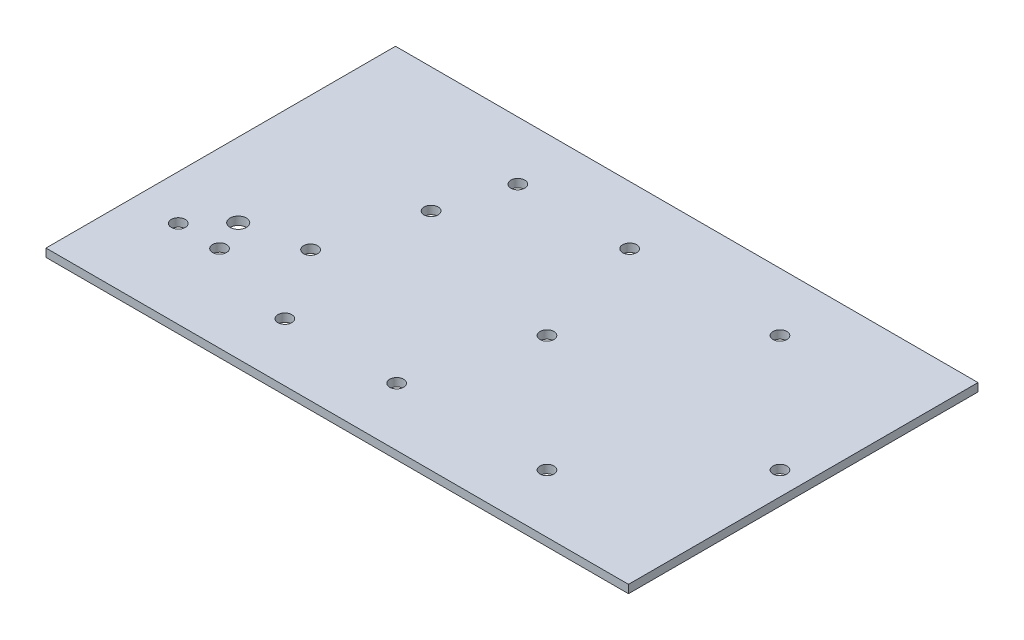
from build123d import *

# Parameters (mm, degrees)
SKETCH_1_W           = 250
SKETCH_1_H           = 150
EXTRUDE_1_DEPTH      = 5
SKETCH_1_4_R         = 3
CUT_EXTRUDE_1_DEPTH  = 5
SKETCH_1_5_R         = 3
CUT_EXTRUDE_2_DEPTH  = 5
SKETCH_1_6_R         = 3
CUT_EXTRUDE_3_DEPTH  = 5
SKETCH_1_7_R         = 3
CUT_EXTRUDE_4_DEPTH  = 5
SKETCH_2_R           = 3
CUT_EXTRUDE_5_DEPTH  = 5
SKETCH_3_R           = 3
CUT_EXTRUDE_6_DEPTH  = 45
SKETCH_3_3_R         = 3.5
CUT_EXTRUDE_7_DEPTH  = 45
SKETCH_4_R           = 3
CUT_EXTRUDE_8_DEPTH  = 5
SKETCH_4_3_R         = 3
CUT_EXTRUDE_9_DEPTH  = 5
SKETCH_5_R           = 3
CUT_EXTRUDE_10_DEPTH = 5
SKETCH_6_W           = 250
SKETCH_6_H           = 150
SKETCH_6_R           = 3
SKETCH_6_R_2         = 3.5
CUT_EXTRUDE_11_DEPTH = 1.5
SKETCH_7_R           = 3
CUT_EXTRUDE_12_DEPTH = 205.296965225


with BuildPart() as part:
    # 草圖1 → 填料-伸長1 (new body)
    with BuildSketch(Plane(origin=(0, 0, 0), x_dir=(1, 0, 0), z_dir=(0, 1, 0))):
        with Locations((-65, 0)):
            Rectangle(SKETCH_1_W, SKETCH_1_H)
    extrude(amount=-EXTRUDE_1_DEPTH)

    # 草圖1<4> → 除料-伸長1 (cut)
    with BuildSketch(Plane(origin=(0, 0, 0), x_dir=(1, 0, 0), z_dir=(0, 1, 0))):
        with Locations((0, 50)):
            Circle(SKETCH_1_4_R)
    extrude(amount=-CUT_EXTRUDE_1_DEPTH, mode=Mode.SUBTRACT)

    # 草圖1<5> → 除料-伸長2 (cut)
    with BuildSketch(Plane(origin=(0, 0, 0), x_dir=(1, 0, 0), z_dir=(0, 1, 0))):
        with Locations((-50, 0)):
            Circle(SKETCH_1_5_R)
    extrude(amount=-CUT_EXTRUDE_2_DEPTH, mode=Mode.SUBTRACT)

    # 草圖1<6> → 除料-伸長3 (cut)
    with BuildSketch(Plane(origin=(0, 0, 0), x_dir=(1, 0, 0), z_dir=(0, 1, 0))):
        with Locations((0, -50)):
            Circle(SKETCH_1_6_R)
    extrude(amount=-CUT_EXTRUDE_3_DEPTH, mode=Mode.SUBTRACT)

    # 草圖1<7> → 除料-伸長4 (cut)
    with BuildSketch(Plane(origin=(0, 0, 0), x_dir=(1, 0, 0), z_dir=(0, 1, 0))):
        with Locations((50, 0)):
            Circle(SKETCH_1_7_R)
    extrude(amount=-CUT_EXTRUDE_4_DEPTH, mode=Mode.SUBTRACT)

    # 草圖2 → 除料-伸長5 (cut)
    with BuildSketch(Plane(origin=(0, 0, 0), x_dir=(1, 0, 0), z_dir=(0, 1, 0))):
        with Locations((-170.76, -37.46)):
            Circle(SKETCH_2_R)
    extrude(amount=-CUT_EXTRUDE_5_DEPTH, mode=Mode.SUBTRACT)

    # 草圖3 → 除料-伸長6 (cut)
    with BuildSketch(Plane(origin=(0, 0, 0), x_dir=(1, 0, 0), z_dir=(0, 1, 0))):
        with Locations((-152.57, -37.93)):
            Circle(SKETCH_3_R)
    extrude(amount=-CUT_EXTRUDE_6_DEPTH, mode=Mode.SUBTRACT)

    # 草圖3<3> → 除料-伸長7 (cut)
    with BuildSketch(Plane(origin=(0, 0, 0), x_dir=(1, 0, 0), z_dir=(0, 1, 0))):
        with Locations((-158.16, -24.34)):
            Circle(SKETCH_3_3_R)
    extrude(amount=-CUT_EXTRUDE_7_DEPTH, mode=Mode.SUBTRACT)

    # 草圖4 → 除料-伸長8 (cut)
    with BuildSketch(Plane(origin=(0, 0, 0), x_dir=(1, 0, 0), z_dir=(0, 1, 0))):
        with Locations((-112.5, -50)):
            Circle(SKETCH_4_R)
    extrude(amount=-CUT_EXTRUDE_8_DEPTH, mode=Mode.SUBTRACT)

    # 草圖4<3> → 除料-伸長9 (cut)
    with BuildSketch(Plane(origin=(0, 0, 0), x_dir=(1, 0, 0), z_dir=(0, 1, 0))):
        with Locations((-64.5, -50)):
            Circle(SKETCH_4_3_R)
    extrude(amount=-CUT_EXTRUDE_9_DEPTH, mode=Mode.SUBTRACT)

    # 草圖5 → 除料-伸長10 (cut)
    with BuildSketch(Plane(origin=(0, 0, 0), x_dir=(1, 0, 0), z_dir=(0, 1, 0))):
        with Locations((-132.61, -18.84)):
            Circle(SKETCH_5_R)
        with Locations((-121.14, 21.42)):
            Circle(SKETCH_5_R)
    extrude(amount=-CUT_EXTRUDE_10_DEPTH, mode=Mode.SUBTRACT)

    # 草圖6 → 除料-伸長11 (cut)
    with BuildSketch(Plane(origin=(0, 0, 0), x_dir=(1, 0, 0), z_dir=(0, 1, 0))):
        with Locations((-65, 0)):
            Rectangle(SKETCH_6_W, SKETCH_6_H)
        with Locations((-170.76, -37.46)):
            Circle(SKETCH_6_R, mode=Mode.SUBTRACT)
        with Locations((-158.16, -24.34)):
            Circle(SKETCH_6_R_2, mode=Mode.SUBTRACT)
        with Locations((-152.57, -37.93)):
            Circle(SKETCH_6_R, mode=Mode.SUBTRACT)
        with Locations((-132.61, -18.84)):
            Circle(SKETCH_6_R, mode=Mode.SUBTRACT)
        with Locations((-112.5, -50)):
            Circle(SKETCH_6_R, mode=Mode.SUBTRACT)
        with Locations((-121.14, 21.42)):
            Circle(SKETCH_6_R, mode=Mode.SUBTRACT)
        with Locations((-50, 0)):
            Circle(SKETCH_6_R, mode=Mode.SUBTRACT)
        with Locations((-64.5, -50)):
            Circle(SKETCH_6_R, mode=Mode.SUBTRACT)
        with Locations((0, 50)):
            Circle(SKETCH_6_R, mode=Mode.SUBTRACT)
        with Locations((0, -50)):
            Circle(SKETCH_6_R, mode=Mode.SUBTRACT)
        with Locations((50, 0)):
            Circle(SKETCH_6_R, mode=Mode.SUBTRACT)
    extrude(amount=-CUT_EXTRUDE_11_DEPTH, mode=Mode.SUBTRACT)

    # 草圖7 → 除料-伸長12 (cut, through all)
    with BuildSketch(Plane(origin=(0, -1.5, 0), x_dir=(1, 0, 0), z_dir=(0, 1, 0))):
        with Locations((-64.5, 50)):
            Circle(SKETCH_7_R)
        with Locations((-112.5, 50)):
            Circle(SKETCH_7_R)
        with Locations((-64.5, -50)):
            Circle(SKETCH_7_R)
        with Locations((-112.5, -50)):
            Circle(SKETCH_7_R)
    extrude(amount=-CUT_EXTRUDE_12_DEPTH, mode=Mode.SUBTRACT)


solid = part.part
